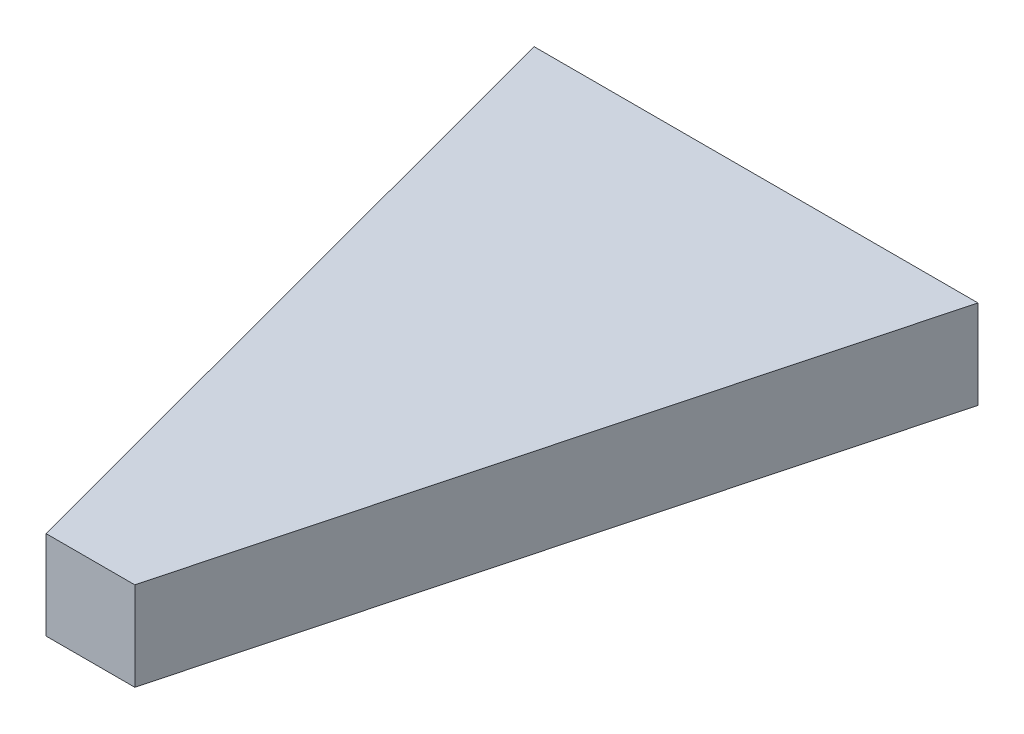
from build123d import *

# Parameters (mm, degrees)
VIRTUAL_CARGO_EXTRUDE_DEPTH = 8


with BuildPart() as part:
    # Virtual cargo → Virtual cargo extrude (new body)
    with BuildSketch(Plane(origin=(0, 0, 0), x_dir=(1, 0, 0), z_dir=(0, 1, 0))):
        Polygon((-55.252382204, 24.077826537), (-15.252382204, 24.077826537), (-31.252382204, -35.922173463), (-39.252382204, -35.922173463), align=None)
    extrude(amount=VIRTUAL_CARGO_EXTRUDE_DEPTH)


solid = part.part
